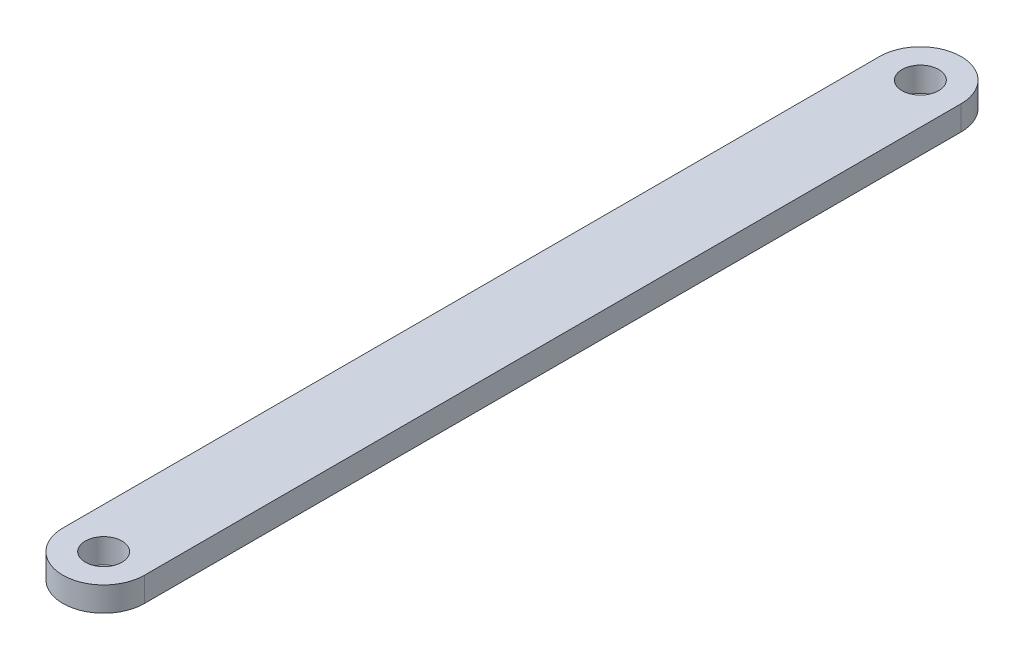
from build123d import *

# Parameters (mm, degrees)
SKETCH_1_R      = 2.25
EXTRUDE_1_DEPTH = 3


with BuildPart() as part:
    # 草图1 → 凸台-拉伸1 (new body)
    with BuildSketch(Plane(origin=(0, 0, 0), x_dir=(1, 0, 0), z_dir=(0, 1, 0))):
        with BuildLine():
            Line((5, 0), (5, -100))
            ThreePointArc((5, -100), (0, -105), (-5, -100))
            Line((-5, -100), (-5, 0))
            ThreePointArc((-5, 0), (0, 5), (5, 0))
        make_face()
        with Locations(Location((0, 0, 0), (0, 0, 270))):
            Circle(SKETCH_1_R, mode=Mode.SUBTRACT)
        with Locations(Location((0, -100, 0), (0, 0, 270))):
            Circle(SKETCH_1_R, mode=Mode.SUBTRACT)
    extrude(amount=EXTRUDE_1_DEPTH)


solid = part.part
